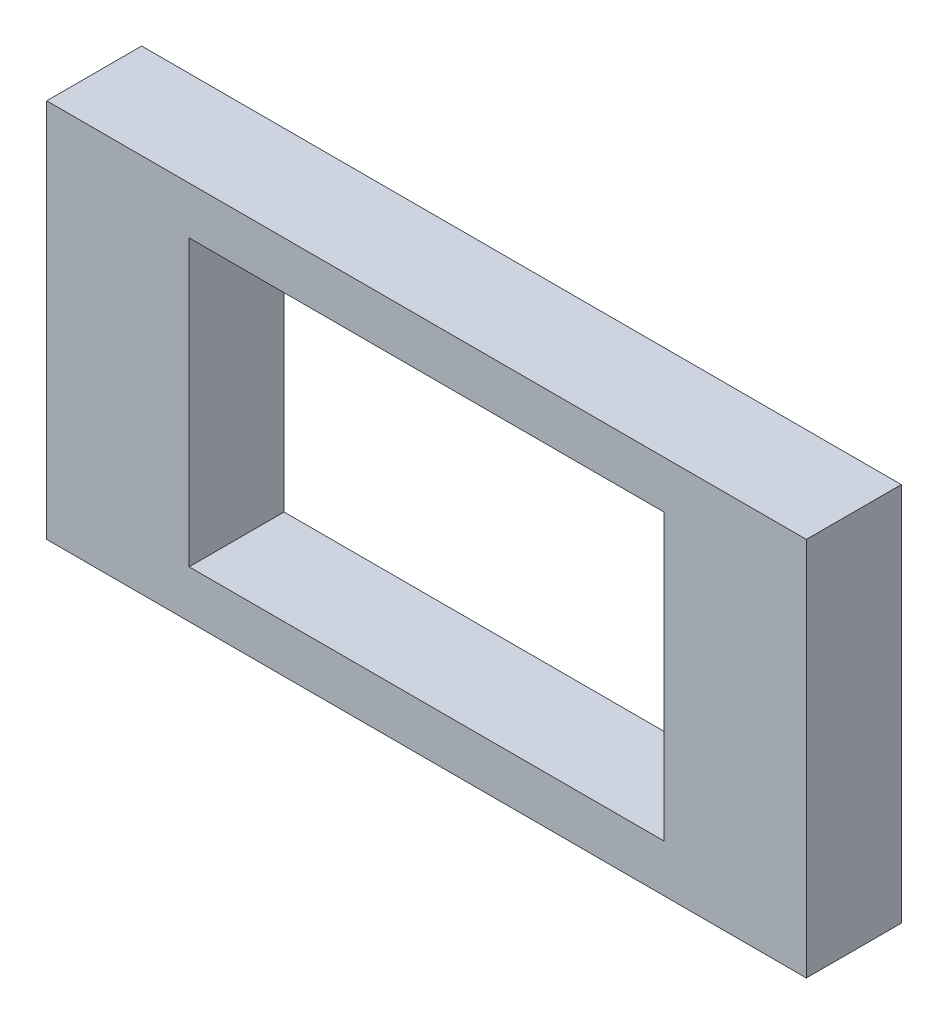
from build123d import *

# Parameters (mm, degrees)
SKETCH_1_W      = 16
SKETCH_1_H      = 8
SKETCH_1_W_2    = 10
SKETCH_1_H_2    = 6
EXTRUDE_1_DEPTH = 2


with BuildPart() as part:
    # 스케치1 → 보스-돌출1 (new body)
    with BuildSketch(Plane.XY):
        Rectangle(SKETCH_1_W, SKETCH_1_H)
        Rectangle(SKETCH_1_W_2, SKETCH_1_H_2, mode=Mode.SUBTRACT)
    extrude(amount=EXTRUDE_1_DEPTH)


solid = part.part
